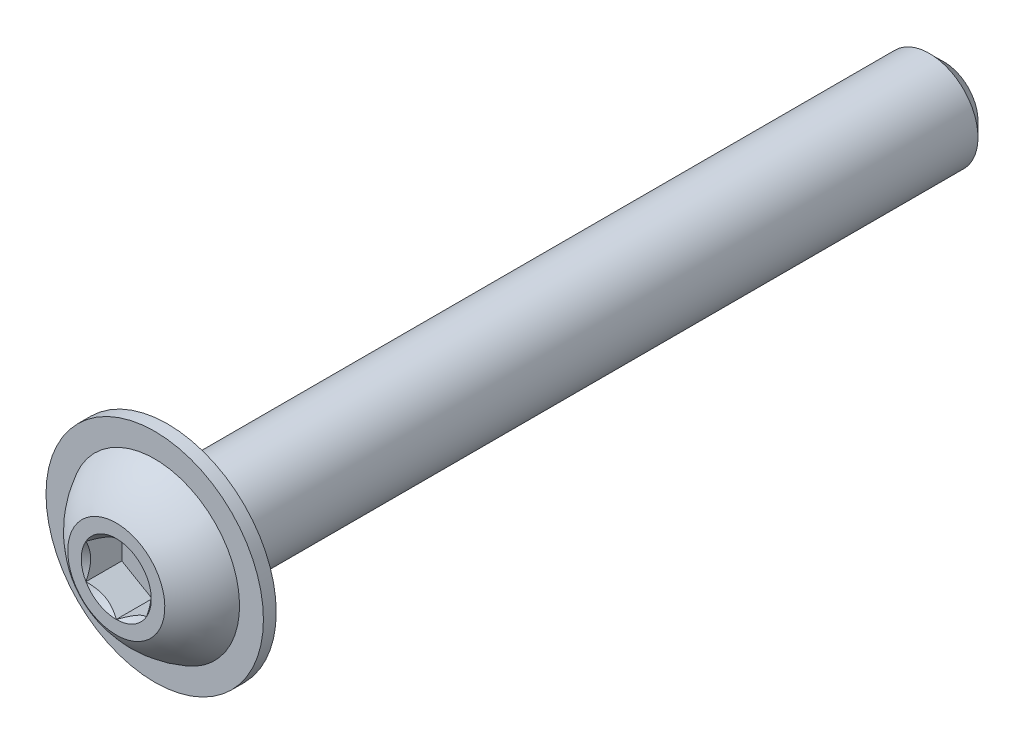
from build123d import *

# Parameters (mm, degrees)
SKETCH1_W           = 50.8
SKETCH1_H           = 3.175
CHAMFER1_SIZE       = 0.9525
SKETCH11_R          = 7.112
BOSS_EXTRUDE3_DEPTH = 0.8382
CUT_EXTRUDE2_DEPTH  = 2.34696


with BuildPart() as part:
    # Sketch1 → Revolve1 (revolve)
    with BuildSketch(Plane(origin=(0, 0, 0), x_dir=(0, 0, -1), z_dir=(1, 0, 0))):
        with Locations((28.7528, 1.5875)):
            Rectangle(SKETCH1_W, SKETCH1_H)
    revolve(axis=Axis((0, 0, -54.1528), (0, 0, 1)))

    # Chamfer1
    chamfer1_edges = [part.edges().sort_by_distance(p)[0] for p in [
        (0, -3.175, -54.1528),
    ]]
    chamfer(chamfer1_edges, length=CHAMFER1_SIZE)

    # Sketch7 → Revolve2 (revolve)
    with BuildSketch(Plane(origin=(0, 0, 0), x_dir=(0, 0, -1), z_dir=(1, 0, 0)), mode=Mode.PRIVATE) as revolve2_sk:
        with BuildLine():
            Line((2.5146, 5.5499), (3.3528, 5.5499))
            Line((3.3528, 5.5499), (3.3528, 0))
            Line((3.3528, 0), (0, 0))
            Line((0, 0), (0, 3.175))
            ThreePointArc((0, 3.175), (1.089595864, 4.540019085), (2.5146, 5.5499))
        make_face()
    revolve(revolve2_sk.sketch.rotate(Axis((0, 0, 0), (0, 0, -1)), 180), axis=Axis((0, 0, 0), (0, 0, -1)))

    # Sketch11 → Boss-Extrude3 (add)
    with BuildSketch(Plane(origin=(0, 0, -3.3528), x_dir=(-1, 0, 0), z_dir=(0, 0, -1))):
        Circle(SKETCH11_R)
    extrude(amount=-BOSS_EXTRUDE3_DEPTH)

    # Sketch5 → Cut-Extrude2 (cut)
    with BuildSketch(Plane.XY):
        Polygon((1.984375, -1.14567944), (1.984375, 1.14567944), (0, 2.291358881), (-1.984375, 1.14567944), (-1.984375, -1.14567944), (0, -2.291358881), align=None)
    extrude(amount=-CUT_EXTRUDE2_DEPTH, mode=Mode.SUBTRACT)

    # Cut-Extrude3 cone 1 section (through the dimple's axis) → Cut-Extrude3 (revolve, cut)
    with BuildSketch(Plane(origin=(0, 0, 0), x_dir=(0, -1, 0), z_dir=(1, 0, 0))):
        Polygon((0, 0), (2.291358881, 0), (0, 2.291358881), align=None)
    revolve(axis=Axis((0, 0, 0), (0, 0, -1)), mode=Mode.SUBTRACT)


solid = part.part
